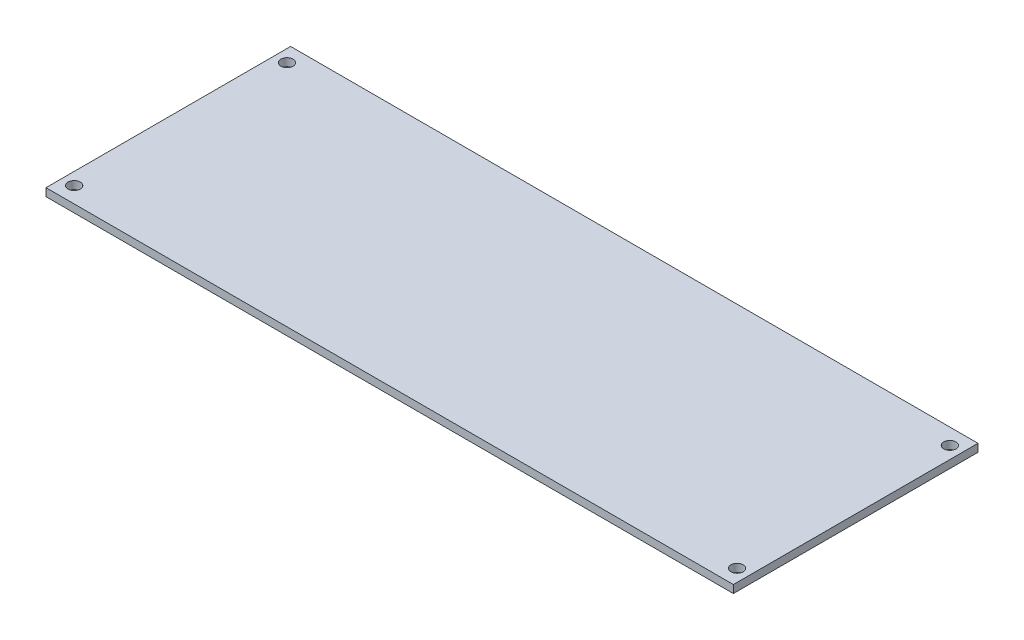
from build123d import *

# Parameters (mm, degrees)
SKETCH1_W           = 140.5
SKETCH1_H           = 50
SKETCH1_R           = 1.25
BOSS_EXTRUDE1_DEPTH = 1.6


with BuildPart() as part:
    # Sketch1 → Boss-Extrude1 (new body)
    with BuildSketch(Plane(origin=(0, 0, 0), x_dir=(1, 0, 0), z_dir=(0, 1, 0))):
        Rectangle(SKETCH1_W, SKETCH1_H)
        with Locations(Location((-67.75, 21.75, 0), (0, 0, 270))):
            Circle(SKETCH1_R, mode=Mode.SUBTRACT)
        with Locations(Location((67.75, 21.75, 0), (0, 0, 90))):
            Circle(SKETCH1_R, mode=Mode.SUBTRACT)
        with Locations(Location((67.75, -21.75, 0), (0, 0, 270))):
            Circle(SKETCH1_R, mode=Mode.SUBTRACT)
        with Locations(Location((-67.75, -21.75, 0), (0, 0, 90))):
            Circle(SKETCH1_R, mode=Mode.SUBTRACT)
    extrude(amount=BOSS_EXTRUDE1_DEPTH)


solid = part.part
